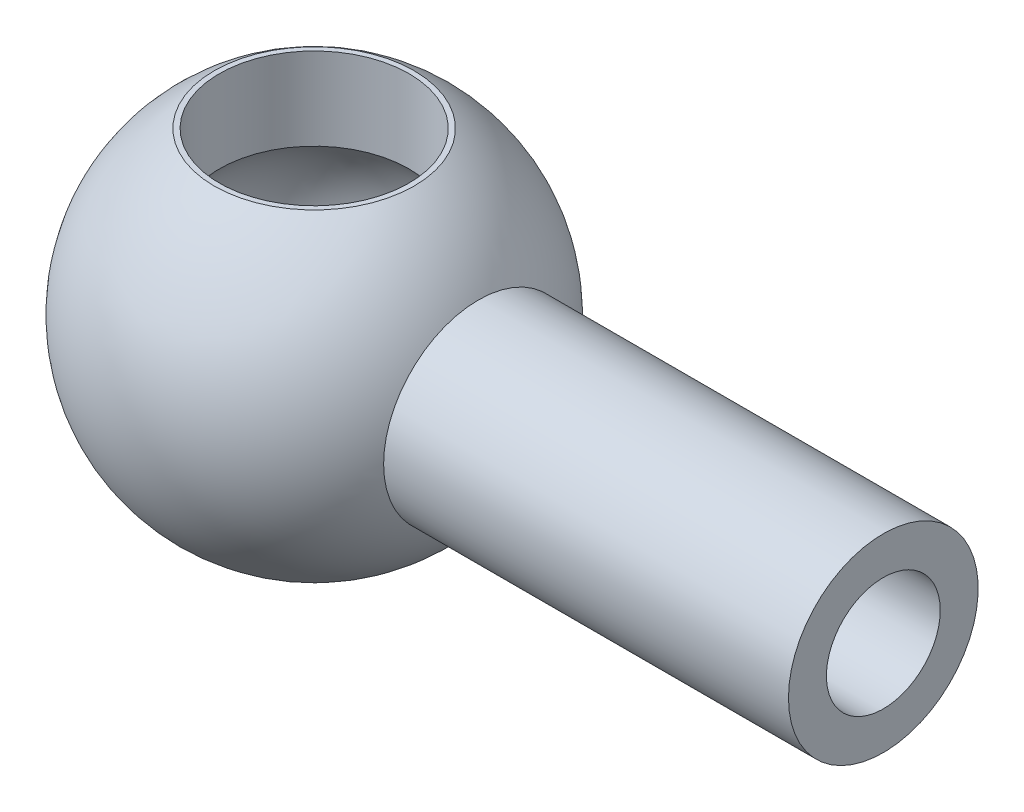
from build123d import *

# Parameters (mm, degrees)
SKETCH3_R                    = 3
CUT_EXTRUDE2_DEPTH           = 10
SKETCH4_R                    = 5
CUT_EXTRUDE3_DEPTH           = 15
CUT_EXTRUDE_THIN2_DEPTH      = 10
CUT_EXTRUDE_THIN2_DEPTH_BACK = 10
SKETCH5_W                    = 45
SKETCH5_H                    = 37
SKETCH5_W_2                  = 25
SKETCH5_H_2                  = 17


with BuildPart() as part:
    # Sketch1 → Revolve3 (revolve)
    with BuildSketch(Plane.XY, mode=Mode.PRIVATE) as revolve3_sk:
        with BuildLine():
            Line((30, -5), (30, 0))
            Line((30, 0), (5, 0))
            ThreePointArc((5, 0), (0, -5), (-5, 0))
            Line((-5, 0), (-10, 0))
            ThreePointArc((-10, 0), (-2.588190451, -9.659258263), (8.660254038, -5))
            Line((8.660254038, -5), (30, -5))
        make_face()
    revolve(revolve3_sk.sketch.rotate(Axis((-13.11573237, 0, 0), (1, 0, 0)), 270), axis=Axis((-13.11573237, 0, 0), (1, 0, 0)))

    # Sketch3 → Cut-Extrude2 (cut)
    with BuildSketch(Plane(origin=(30, 0, 0), x_dir=(0, 0, -1), z_dir=(1, 0, 0))):
        Circle(SKETCH3_R)
    extrude(amount=-CUT_EXTRUDE2_DEPTH, mode=Mode.SUBTRACT)

    # Sketch2 → Cut-Revolve1 (revolve, cut)
    with BuildSketch(Plane.XY):
        with BuildLine():
            Line((-6.5, 0), (6.5, 0))
            ThreePointArc((6.5, 0), (0, -6.5), (-6.5, 0))
        make_face()
    revolve(axis=Axis((-6.5, 0, 0), (1, 0, 0)), mode=Mode.SUBTRACT)

    # Sketch4 → Cut-Extrude3 (cut, symmetric)
    with BuildSketch(Plane(origin=(0, 0, 0), x_dir=(1, 0, 0), z_dir=(0, 1, 0))):
        with Locations(Location((0, 0, 0), (0, 0, 270))):
            Circle(SKETCH4_R)
    extrude(amount=CUT_EXTRUDE3_DEPTH, both=True, mode=Mode.SUBTRACT)

    # Sketch5 → Cut-Extrude-Thin2 (cut, two sides: drawn at the far end of the back side and taken through both)
    with BuildSketch(Plane(origin=(0, 0, 0), x_dir=(0, 0, -1), z_dir=(1, 0, 0)).offset(-CUT_EXTRUDE_THIN2_DEPTH_BACK)):
        Rectangle(SKETCH5_W, SKETCH5_H)
        Rectangle(SKETCH5_W_2, SKETCH5_H_2, mode=Mode.SUBTRACT)
    extrude(amount=CUT_EXTRUDE_THIN2_DEPTH + CUT_EXTRUDE_THIN2_DEPTH_BACK, mode=Mode.SUBTRACT)


solid = part.part
